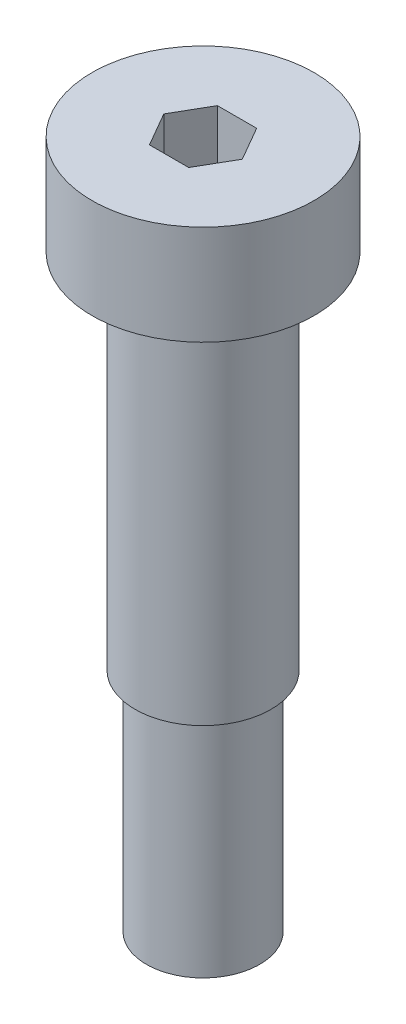
from build123d import *

# Parameters (mm, degrees)
CUT_EXTRUDE_1_DEPTH = 3


with BuildPart() as part:
    # 草图1 → 旋转1 (revolve)
    with BuildSketch(Plane.XY, mode=Mode.PRIVATE) as revolve_1_sk:
        Polygon((0, 0), (0, 30.4), (4.9, 30.4), (4.9, 26), (3, 26), (3, 10), (2.5, 10), (2.5, 0), align=None)
    revolve(revolve_1_sk.sketch.rotate(Axis((0, 0, 0), (0, 1, 0)), 90), axis=Axis((0, 0, 0), (0, 1, 0)))

    # 草图2 → 切除-拉伸1 (cut)
    with BuildSketch(Plane(origin=(0, 30.4, 0), x_dir=(1, 0, 0), z_dir=(0, 1, 0))):
        Polygon((1.732050808, 0), (0.866025404, 1.5), (-0.866025404, 1.5), (-1.732050808, 0), (-0.866025404, -1.5), (0.866025404, -1.5), align=None)
    extrude(amount=-CUT_EXTRUDE_1_DEPTH, mode=Mode.SUBTRACT)


solid = part.part
